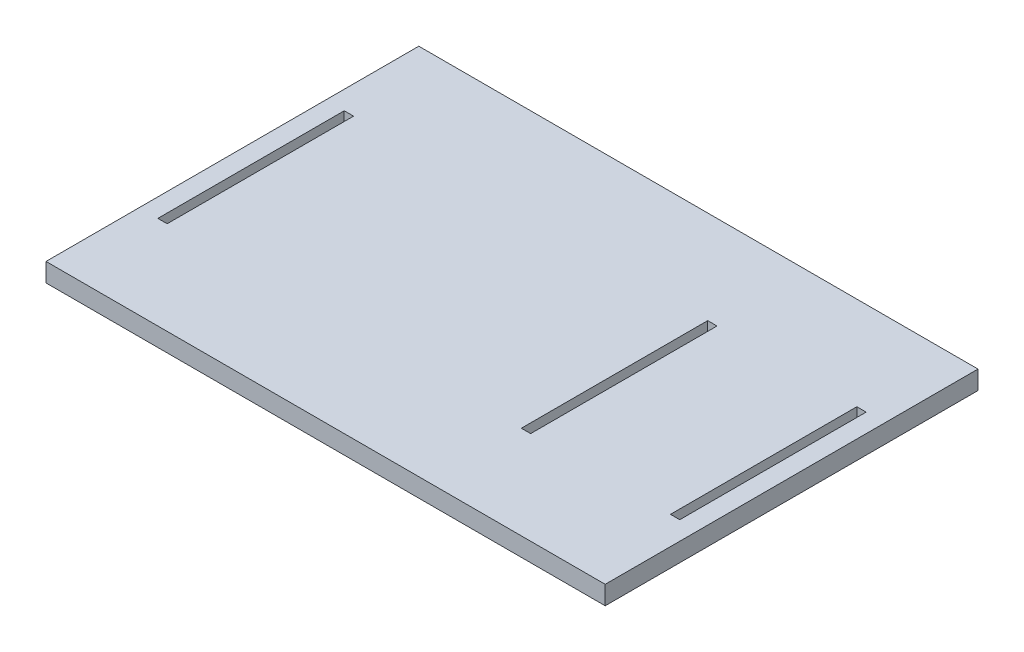
from build123d import *

# Parameters (mm, degrees)
CROQUIS1_W              = 300
CROQUIS1_H              = 200
CROQUIS1_W_2            = 5
CROQUIS1_H_2            = 100
SALIENTE_EXTRUIR1_DEPTH = 10


with BuildPart() as part:
    # Croquis1 → Saliente-Extruir1 (new body)
    with BuildSketch(Plane(origin=(0, 0, 0), x_dir=(1, 0, 0), z_dir=(0, 1, 0))):
        Rectangle(CROQUIS1_W, CROQUIS1_H)
        with Locations((137.5, 0)):
            Rectangle(CROQUIS1_W_2, CROQUIS1_H_2, mode=Mode.SUBTRACT)
        with Locations((-137.5, 0)):
            Rectangle(CROQUIS1_W_2, CROQUIS1_H_2, mode=Mode.SUBTRACT)
        with Locations((57.5, 0)):
            Rectangle(CROQUIS1_W_2, CROQUIS1_H_2, mode=Mode.SUBTRACT)
    extrude(amount=SALIENTE_EXTRUIR1_DEPTH)


solid = part.part
